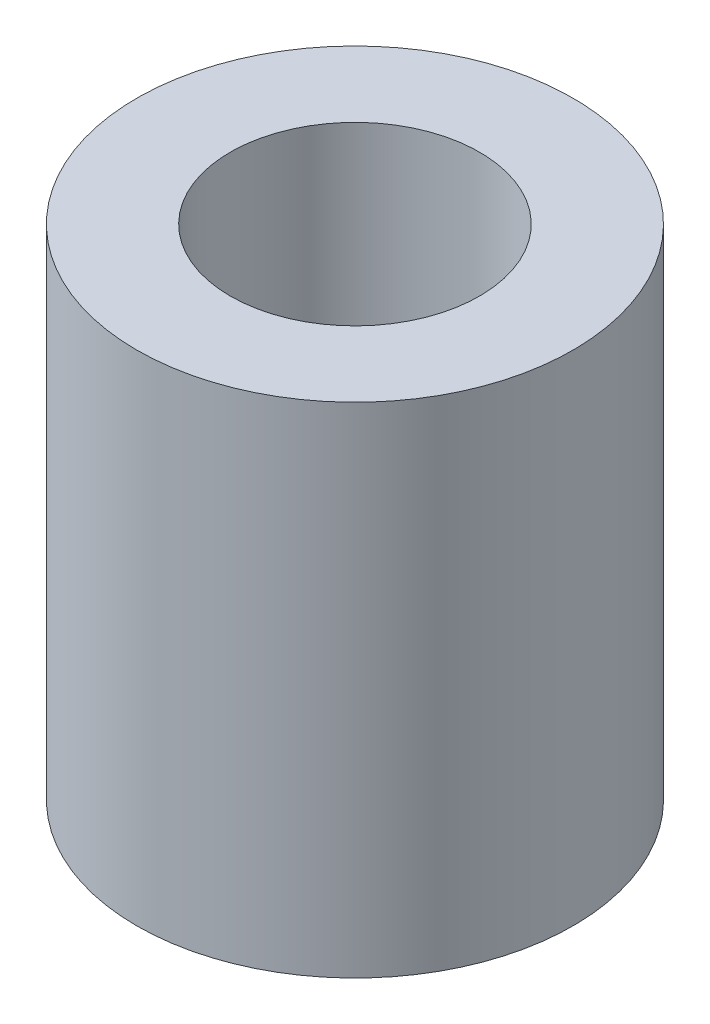
from build123d import *

# Parameters (mm, degrees)
SKETCH_1_R      = 3.5
SKETCH_1_R_2    = 2
EXTRUDE_1_DEPTH = 8


with BuildPart() as part:
    # Эскиз1 → Бобышка-Вытянуть1 (new body)
    with BuildSketch(Plane(origin=(0, 0, 0), x_dir=(1, 0, 0), z_dir=(0, 1, 0))):
        with Locations(Location((0, 0, 0), (0, 0, 270))):
            Circle(SKETCH_1_R)
        with Locations(Location((0, 0, 0), (0, 0, 270))):
            Circle(SKETCH_1_R_2, mode=Mode.SUBTRACT)
    extrude(amount=EXTRUDE_1_DEPTH)


solid = part.part
